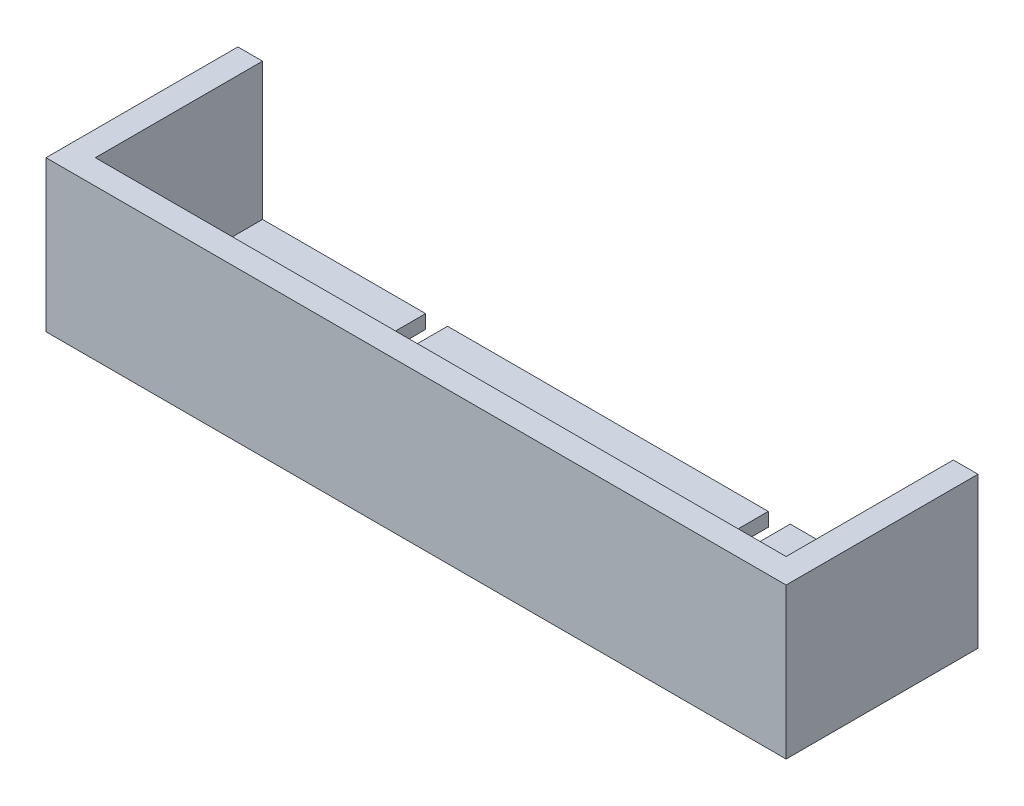
from build123d import *

# Parameters (mm, degrees)
ESQUISSE1_W             = 54
ESQUISSE1_H             = 14
ESQUISSE1_W_2           = 50.4
ESQUISSE1_H_2           = 10.4
BOSS_EXTRU_1_DEPTH      = 10
ESQUISSE2_W             = 54
ESQUISSE2_H             = 14
BOSS_EXTRU_2_DEPTH      = 1
ENL_V_MAT_EXTRU_1_DEPTH = 1
ESQUISSE4_W             = 50.4
ESQUISSE4_H             = 10
ENL_V_MAT_EXTRU_2_DEPTH = 1.8


with BuildPart() as part:
    # Esquisse1 → Boss.-Extru.1 (new body)
    with BuildSketch(Plane(origin=(0, 0, 0), x_dir=(1, 0, 0), z_dir=(0, 1, 0))):
        Rectangle(ESQUISSE1_W, ESQUISSE1_H)
        Rectangle(ESQUISSE1_W_2, ESQUISSE1_H_2, mode=Mode.SUBTRACT)
    extrude(amount=BOSS_EXTRU_1_DEPTH)

    # Esquisse2 → Boss.-Extru.2 (add)
    with BuildSketch(Plane(origin=(0, 0, 0), x_dir=(-1, 0, 0), z_dir=(0, -1, 0))):
        Rectangle(ESQUISSE2_W, ESQUISSE2_H)
    extrude(amount=BOSS_EXTRU_2_DEPTH)

    # Esquisse3 → Enlèv. mat.-Extru.1 (cut)
    with BuildSketch(Plane(origin=(0, 0, 0), x_dir=(1, 0, 0), z_dir=(0, 1, 0))):
        with BuildLine():
            Line((-13.3, 0), (-13.3, 7))
            Line((-13.3, 7), (-11.7, 7))
            Line((-11.7, 7), (-11.7, 0))
            ThreePointArc((-11.7, 0), (-12.5, -0.8), (-13.3, 0))
        make_face()
        with BuildLine():
            Line((11.7, 0), (11.7, 7))
            Line((11.7, 7), (13.3, 7))
            Line((13.3, 7), (13.3, 0))
            ThreePointArc((13.3, 0), (12.5, -0.8), (11.7, 0))
        make_face()
    extrude(amount=-ENL_V_MAT_EXTRU_1_DEPTH, mode=Mode.SUBTRACT)

    # Esquisse4 → Enlèv. mat.-Extru.2 (cut)
    with BuildSketch(Plane.XY.offset(-5.2)):
        with Locations((0, 5)):
            Rectangle(ESQUISSE4_W, ESQUISSE4_H)
    extrude(amount=-ENL_V_MAT_EXTRU_2_DEPTH, mode=Mode.SUBTRACT)


solid = part.part
